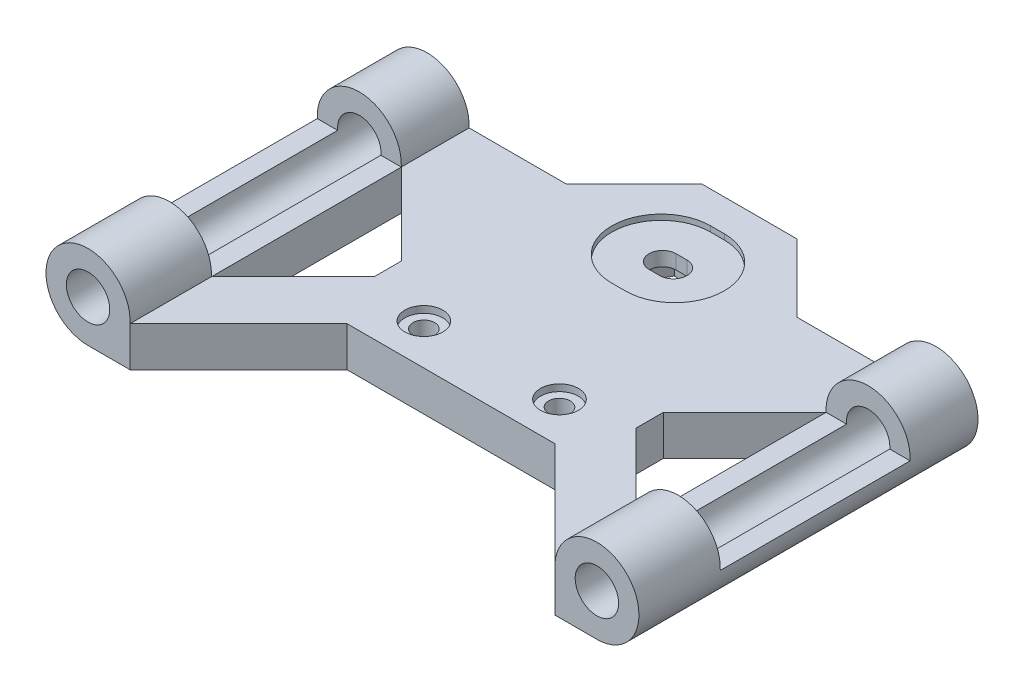
from build123d import *

# Parameters (mm, degrees)
SKETCH_1_R             = 3.1
SKETCH_1_R_2           = 1.6
EXTRUDE_1_DEPTH        = 25
EXTRUDE_2_DEPTH        = 2.945
CUT_EXTRUDE_1_DEPTH    = 56.64644355
CUT_EXTRUDE_START      = -1.5
CUT_EXTRUDE_2844_DEPTH = 1.5
SKETCH_6_R             = 0.8
CUT_EXTRUDE_5_DEPTH    = 56.64644355
CUT_EXTRUDE_6_DEPTH    = 56.64644355
SKETCH_9_W             = 14
SKETCH_9_H             = 3.255
CUT_EXTRUDE_9_DEPTH    = 46.904396246
SKETCH_10_R            = 1.4
CUT_EXTRUDE_11_DEPTH   = 0.5
CUT_EXTRUDE_12_DEPTH   = 0.4


with BuildPart() as part:
    # 草图1 → 凸台-拉伸1 (new body)
    # profile 1 of 3: a face of its own
    with BuildSketch(Plane.XY):
        with Locations((-46.507778168, 5.529205914)):
            Circle(SKETCH_1_R)
        with Locations((-46.507778168, 5.529205914)):
            Circle(SKETCH_1_R_2, mode=Mode.SUBTRACT)
    # profile 2 of 3: a face of its own
    with BuildSketch(Plane.XY):
        with BuildLine():
            ThreePointArc((-43.411655593, 5.374205914), (-44.371250611, 3.283042519), (-46.507778168, 2.429205914))
            Line((-46.507778168, 2.429205914), (-8.987778168, 2.429205914))
            ThreePointArc((-8.987778168, 2.429205914), (-11.124305724, 3.283042519), (-12.083900743, 5.374205914))
            Line((-12.083900743, 5.374205914), (-43.411655593, 5.374205914))
        make_face()
    # profile 3 of 3: a face of its own
    with BuildSketch(Plane.XY):
        with Locations((-8.987778168, 5.529205914)):
            Circle(SKETCH_1_R)
        with Locations((-8.987778168, 5.529205914)):
            Circle(SKETCH_1_R_2, mode=Mode.SUBTRACT)
    extrude(amount=EXTRUDE_1_DEPTH)

    # 草图2 → 凸台-拉伸2 (add)
    with BuildSketch(Plane(origin=(0, 5.374205914, 0), x_dir=(1, 0, 0), z_dir=(0, 1, 0))):
        Polygon((-19.247778168, 0), (-24.247778168, 5), (-31.247778168, 5), (-36.247778168, 0), align=None)
    extrude(amount=-EXTRUDE_2_DEPTH)

    # 草图3 → 切除-拉伸1 (cut, through all)
    with BuildSketch(Plane(origin=(0, 5.374205914, 0), x_dir=(1, 0, 0), z_dir=(0, 1, 0))):
        with BuildLine():
            Line((-28.147778168, 0), (-27.347778168, 0))
            ThreePointArc((-27.347778168, 0), (-26.347778168, -1), (-27.347778168, -2))
            Line((-27.347778168, -2), (-28.147778168, -2))
            ThreePointArc((-28.147778168, -2), (-29.147778168, -1), (-28.147778168, 0))
        make_face()
    extrude(amount=-CUT_EXTRUDE_1_DEPTH, mode=Mode.SUBTRACT)

    # 草图5 → Cut-Extrude 2844 (cut)
    # profile 1 of 3: a face of its own
    with BuildSketch(Plane(origin=(0, 2.429205914, 0), x_dir=(-1, 0, 0), z_dir=(0, -1, 0)).offset(CUT_EXTRUDE_START)):
        Polygon((25.780642064, -1), (26.964210116, 1.05), (26.164210116, 1.05), (24.980642064, -1), (26.164210116, -3.05), (26.964210116, -3.05), align=None)
    # profile 2 of 3: a face of its own
    with BuildSketch(Plane(origin=(0, 2.429205914, 0), x_dir=(-1, 0, 0), z_dir=(0, -1, 0)).offset(CUT_EXTRUDE_START)):
        Polygon((28.53134622, -3.05), (29.714914272, -1), (28.53134622, 1.05), (26.964210116, 1.05), (25.780642064, -1), (26.964210116, -3.05), align=None)
        with BuildLine():
            ThreePointArc((27.347778168, -2), (26.347778168, -1), (27.347778168, 0))
            Line((27.347778168, 0), (28.147778168, 0))
            ThreePointArc((28.147778168, 0), (29.147778168, -1), (28.147778168, -2))
            Line((28.147778168, -2), (27.347778168, -2))
        make_face(mode=Mode.SUBTRACT)
    # profile 3 of 3: a face of its own
    with BuildSketch(Plane(origin=(0, 2.429205914, 0), x_dir=(-1, 0, 0), z_dir=(0, -1, 0)).offset(CUT_EXTRUDE_START)):
        Polygon((28.53134622, 1.05), (29.714914272, -1), (28.53134622, -3.05), (29.33134622, -3.05), (30.514914272, -1), (29.33134622, 1.05), align=None)
    extrude(amount=CUT_EXTRUDE_2844_DEPTH, mode=Mode.SUBTRACT)

    # 草图6 → 切除-拉伸5 (cut, through all)
    with BuildSketch(Plane(origin=(0, 5.374205914, 0), x_dir=(1, 0, 0), z_dir=(0, 1, 0))):
        with Locations(Location((-32.747778168, -14, 0), (0, 0, 270))):
            Circle(SKETCH_6_R)
        with Locations(Location((-22.747778168, -14, 0), (0, 0, 270))):
            Circle(SKETCH_6_R)
    extrude(amount=-CUT_EXTRUDE_5_DEPTH, mode=Mode.SUBTRACT)

    # 草图7 → 切除-拉伸6 (cut, through all)
    with BuildSketch(Plane(origin=(0, 5.374205914, 0), x_dir=(1, 0, 0), z_dir=(0, 1, 0))):
        Polygon((-35.407778168, -17), (-43.407778168, -25), (-12.083900743, -25), (-20.083900743, -17), align=None)
        Polygon((-37.407778168, -13), (-37.407778168, -11), (-43.407778168, -5), (-43.407778168, -19), align=None)
        Polygon((-12.087778168, -5), (-18.087778168, -11), (-18.087778168, -13), (-12.087778168, -19), align=None)
    extrude(amount=-CUT_EXTRUDE_6_DEPTH, mode=Mode.SUBTRACT)

    # 草图9 → 切除-拉伸9 (cut, through all)
    with BuildSketch(Plane.ZY.offset(12.087778168)):
        with Locations((12, 7.001705914)):
            Rectangle(SKETCH_9_W, SKETCH_9_H)
    cut_extrude_9 = extrude(amount=-CUT_EXTRUDE_9_DEPTH, mode=Mode.SUBTRACT)

    # 镜向1: 切除-拉伸9 across plane
    add(cut_extrude_9.mirror(Plane(origin=(-27.747778168, 0, 0), x_dir=(0, 0, 1), z_dir=(1, 0, 0))), mode=Mode.SUBTRACT)

    # 草图10 → 切除-拉伸11 (cut)
    with BuildSketch(Plane(origin=(0, 5.374205914, 0), x_dir=(1, 0, 0), z_dir=(0, 1, 0))):
        with Locations(Location((-22.747778168, -14, 0), (0, 0, 270))):
            Circle(SKETCH_10_R)
        with Locations(Location((-32.747778168, -14, 0), (0, 0, 270))):
            Circle(SKETCH_10_R)
    extrude(amount=-CUT_EXTRUDE_11_DEPTH, mode=Mode.SUBTRACT)

    # 草图11 → 切除-拉伸12 (cut)
    with BuildSketch(Plane(origin=(0, 5.374205914, 0), x_dir=(1, 0, 0), z_dir=(0, 1, 0))):
        with BuildLine():
            Line((-27.247778168, -4.65), (-28.247778168, -4.65))
            ThreePointArc((-28.247778168, -4.65), (-31.897778168, -1), (-28.247778168, 2.65))
            Line((-28.247778168, 2.65), (-27.247778168, 2.65))
            ThreePointArc((-27.247778168, 2.65), (-23.597778168, -1), (-27.247778168, -4.65))
        make_face()
    extrude(amount=-CUT_EXTRUDE_12_DEPTH, mode=Mode.SUBTRACT)


solid = part.part
